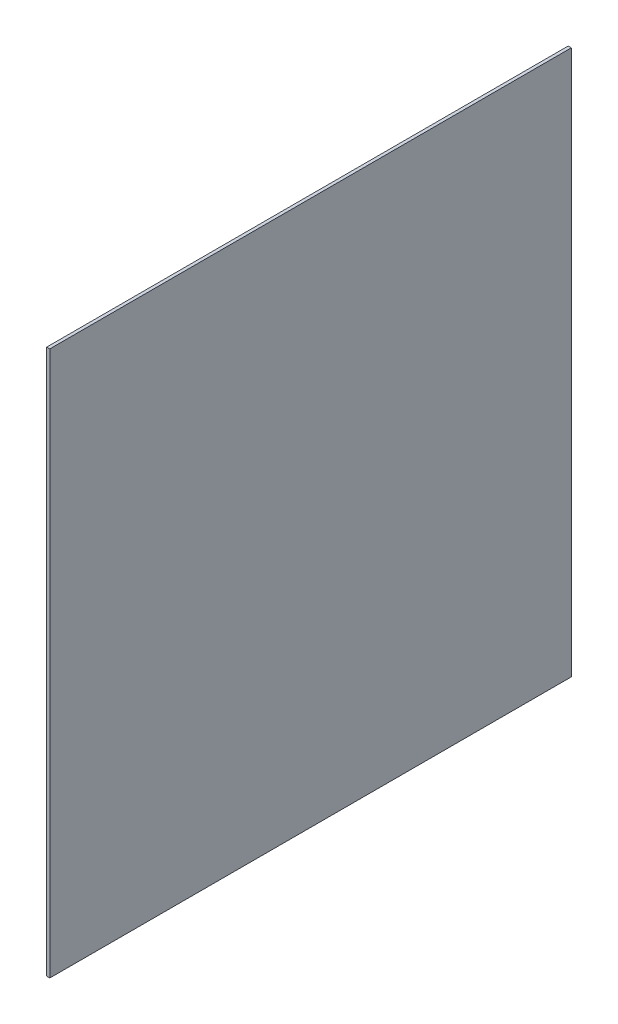
from build123d import *

# Parameters (mm, degrees)
SKETCH_1_W      = 335
SKETCH_1_H      = 350
EXTRUDE_1_DEPTH = 2


with BuildPart() as part:
    # 草图1 → 凸台-拉伸1 (new body)
    with BuildSketch(Plane(origin=(0, 0, 0), x_dir=(0, 0, -1), z_dir=(1, 0, 0))):
        with Locations((167.5, 175)):
            Rectangle(SKETCH_1_W, SKETCH_1_H)
    extrude(amount=EXTRUDE_1_DEPTH)


solid = part.part
